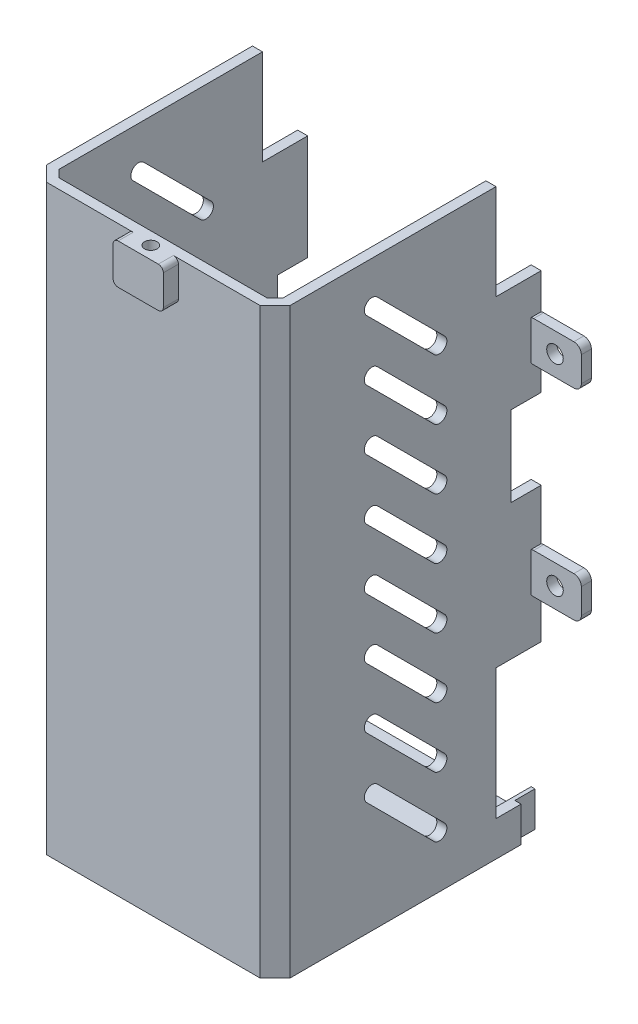
from build123d import *

# Parameters (mm, degrees)
U_2MM_START               = -26
U_2MM_DEPTH               = 116
EXTRUDE_START             = -26
EXTRUDE_377_DEPTH         = 2
EXTRUDE_START_2           = 3
SKETCH_3_R                = 1.65
EXTRUDE_M3_1_20_DEPTH     = 2
SKETCH_4_R                = 1.65
EXTRUDE_M3_1_60_DEPTH     = 2
SKETCH_5_R                = 1.65
EXTRUDE_M3_1_20_2_DEPTH   = 2
SKETCH_6_R                = 1.65
EXTRUDE_M3_1_60_2_DEPTH   = 2
CUT_EXTRUDE_START         = 3
CUT_EXTRUDE_836_DEPTH     = 9
CUT_EXTRUDE_946_DEPTH     = 6
CUT_EXTRUDE_45_DEPTH      = 60
CUT_EXTRUDE_45_DEPTH_BACK = 60
EXTRUDE_START_3           = 54
EXTRUDE_1269_DEPTH        = 5
CUT_EXTRUDE_START_2       = 83
SKETCH_11_R               = 1.25
CUT_EXTRUDE_M3_7_DEPTH    = 7
CUT_EXTRUDE_1485_DEPTH    = 4


with BuildPart() as part:
    # 草图1 → 后抽U形电池仓_2mm主壁_斜切肩 (new body)
    with BuildSketch(Plane(origin=(0, 0, 0), x_dir=(1, 0, 0), z_dir=(0, 1, 0)).offset(U_2MM_START)):
        Polygon((-24.25, -3), (-24.25, -53), (-21.25, -56), (21.25, -56), (24.25, -53), (24.25, -3), (22.25, -3), (22.25, -52.5), (20.75, -54), (-20.75, -54), (-22.25, -52.5), (-22.25, -3), align=None)
    extrude(amount=U_2MM_DEPTH)

    # 草图2 → Extrude 377 (add)
    with BuildSketch(Plane(origin=(0, 0, 0), x_dir=(1, 0, 0), z_dir=(0, 1, 0)).offset(EXTRUDE_START)):
        Polygon((-24.25, -3), (-24.25, -53), (-21.25, -56), (21.25, -56), (24.25, -53), (24.25, -3), align=None)
    extrude(amount=EXTRUDE_377_DEPTH)

    # 草图3 → Extrude M3__-1_20 (add)
    with BuildSketch(Plane.XY.offset(EXTRUDE_START_2)):
        with BuildLine():
            Line((-32.75, 16), (-24.75, 16))
            ThreePointArc((-24.75, 16), (-23.689339828, 16.439339828), (-23.25, 17.5))
            Line((-23.25, 17.5), (-23.25, 22.5))
            ThreePointArc((-23.25, 22.5), (-23.689339828, 23.560660172), (-24.75, 24))
            Line((-24.75, 24), (-32.75, 24))
            ThreePointArc((-32.75, 24), (-33.810660172, 23.560660172), (-34.25, 22.5))
            Line((-34.25, 22.5), (-34.25, 17.5))
            ThreePointArc((-34.25, 17.5), (-33.810660172, 16.439339828), (-32.75, 16))
        make_face()
        with Locations((-29, 20)):
            Circle(SKETCH_3_R, mode=Mode.SUBTRACT)
    extrude(amount=EXTRUDE_M3_1_20_DEPTH)

    # 草图4 → Extrude M3__-1_60 (add)
    with BuildSketch(Plane.XY.offset(EXTRUDE_START_2)):
        with BuildLine():
            Line((-32.75, 56), (-24.75, 56))
            ThreePointArc((-24.75, 56), (-23.689339828, 56.439339828), (-23.25, 57.5))
            Line((-23.25, 57.5), (-23.25, 62.5))
            ThreePointArc((-23.25, 62.5), (-23.689339828, 63.560660172), (-24.75, 64))
            Line((-24.75, 64), (-32.75, 64))
            ThreePointArc((-32.75, 64), (-33.810660172, 63.560660172), (-34.25, 62.5))
            Line((-34.25, 62.5), (-34.25, 57.5))
            ThreePointArc((-34.25, 57.5), (-33.810660172, 56.439339828), (-32.75, 56))
        make_face()
        with Locations((-29, 60)):
            Circle(SKETCH_4_R, mode=Mode.SUBTRACT)
    extrude(amount=EXTRUDE_M3_1_60_DEPTH)

    # 草图5 → Extrude M3__1_20 2 (add)
    with BuildSketch(Plane.XY.offset(EXTRUDE_START_2)):
        with BuildLine():
            Line((24.75, 16), (32.75, 16))
            ThreePointArc((32.75, 16), (33.810660172, 16.439339828), (34.25, 17.5))
            Line((34.25, 17.5), (34.25, 22.5))
            ThreePointArc((34.25, 22.5), (33.810660172, 23.560660172), (32.75, 24))
            Line((32.75, 24), (24.75, 24))
            ThreePointArc((24.75, 24), (23.689339828, 23.560660172), (23.25, 22.5))
            Line((23.25, 22.5), (23.25, 17.5))
            ThreePointArc((23.25, 17.5), (23.689339828, 16.439339828), (24.75, 16))
        make_face()
        with Locations((29, 20)):
            Circle(SKETCH_5_R, mode=Mode.SUBTRACT)
    extrude(amount=EXTRUDE_M3_1_20_2_DEPTH)

    # 草图6 → Extrude M3__1_60 2 (add)
    with BuildSketch(Plane.XY.offset(EXTRUDE_START_2)):
        with BuildLine():
            Line((24.75, 56), (32.75, 56))
            ThreePointArc((32.75, 56), (33.810660172, 56.439339828), (34.25, 57.5))
            Line((34.25, 57.5), (34.25, 62.5))
            ThreePointArc((34.25, 62.5), (33.810660172, 63.560660172), (32.75, 64))
            Line((32.75, 64), (24.75, 64))
            ThreePointArc((24.75, 64), (23.689339828, 63.560660172), (23.25, 62.5))
            Line((23.25, 62.5), (23.25, 57.5))
            ThreePointArc((23.25, 57.5), (23.689339828, 56.439339828), (24.75, 56))
        make_face()
        with Locations((29, 60)):
            Circle(SKETCH_6_R, mode=Mode.SUBTRACT)
    extrude(amount=EXTRUDE_M3_1_60_2_DEPTH)

    # 草图7 → Cut-Extrude 836 (cut)
    with BuildSketch(Plane.XY.offset(CUT_EXTRUDE_START)):
        with BuildLine():
            Line((-33, -19), (33, -19))
            ThreePointArc((33, -19), (34.414213562, -18.414213562), (35, -17))
            Line((35, -17), (35, 5))
            ThreePointArc((35, 5), (34.414213562, 6.414213562), (33, 7))
            Line((33, 7), (-33, 7))
            ThreePointArc((-33, 7), (-34.414213562, 6.414213562), (-35, 5))
            Line((-35, 5), (-35, -17))
            ThreePointArc((-35, -17), (-34.414213562, -18.414213562), (-33, -19))
        make_face()
        with BuildLine():
            Line((-33, 71), (33, 71))
            ThreePointArc((33, 71), (34.414213562, 71.585786438), (35, 73))
            Line((35, 73), (35, 95))
            ThreePointArc((35, 95), (34.414213562, 96.414213562), (33, 97))
            Line((33, 97), (-33, 97))
            ThreePointArc((-33, 97), (-34.414213562, 96.414213562), (-35, 95))
            Line((-35, 95), (-35, 73))
            ThreePointArc((-35, 73), (-34.414213562, 71.585786438), (-33, 71))
        make_face()
    extrude(amount=CUT_EXTRUDE_836_DEPTH, mode=Mode.SUBTRACT)

    # 草图8 → Cut-Extrude 946 (cut)
    with BuildSketch(Plane.XY.offset(CUT_EXTRUDE_START)):
        with BuildLine():
            Line((-25, 34), (25, 34))
            ThreePointArc((25, 34), (26.414213562, 34.585786438), (27, 36))
            Line((27, 36), (27, 48))
            ThreePointArc((27, 48), (26.414213562, 49.414213562), (25, 50))
            Line((25, 50), (-25, 50))
            ThreePointArc((-25, 50), (-26.414213562, 49.414213562), (-27, 48))
            Line((-27, 48), (-27, 36))
            ThreePointArc((-27, 36), (-26.414213562, 34.585786438), (-25, 34))
        make_face()
    extrude(amount=CUT_EXTRUDE_946_DEPTH, mode=Mode.SUBTRACT)

    # 草图9 → 两侧45度平行短通风槽 (cut, two sides: drawn at the far end of the back side and taken through both)
    with BuildSketch(Plane(origin=(0, 0, 0), x_dir=(0, 0, -1), z_dir=(1, 0, 0)).offset(-CUT_EXTRUDE_45_DEPTH_BACK)):
        with BuildLine():
            Line((-22.221825407, -14.656854249), (-35.656854249, -1.221825407))
            ThreePointArc((-35.656854249, -1.221825407), (-37.778174593, -1.221825407), (-37.778174593, -3.343145751))
            Line((-37.778174593, -3.343145751), (-24.343145751, -16.778174593))
            ThreePointArc((-24.343145751, -16.778174593), (-22.221825407, -16.778174593), (-22.221825407, -14.656854249))
        make_face()
        with BuildLine():
            Line((-22.221825407, -2.656854249), (-35.656854249, 10.778174593))
            ThreePointArc((-35.656854249, 10.778174593), (-37.778174593, 10.778174593), (-37.778174593, 8.656854249))
            Line((-37.778174593, 8.656854249), (-24.343145751, -4.778174593))
            ThreePointArc((-24.343145751, -4.778174593), (-22.221825407, -4.778174593), (-22.221825407, -2.656854249))
        make_face()
        with BuildLine():
            Line((-22.221825407, 9.343145751), (-35.656854249, 22.778174593))
            ThreePointArc((-35.656854249, 22.778174593), (-37.778174593, 22.778174593), (-37.778174593, 20.656854249))
            Line((-37.778174593, 20.656854249), (-24.343145751, 7.221825407))
            ThreePointArc((-24.343145751, 7.221825407), (-22.221825407, 7.221825407), (-22.221825407, 9.343145751))
        make_face()
        with BuildLine():
            Line((-22.221825407, 21.343145751), (-35.656854249, 34.778174593))
            ThreePointArc((-35.656854249, 34.778174593), (-37.778174593, 34.778174593), (-37.778174593, 32.656854249))
            Line((-37.778174593, 32.656854249), (-24.343145751, 19.221825407))
            ThreePointArc((-24.343145751, 19.221825407), (-22.221825407, 19.221825407), (-22.221825407, 21.343145751))
        make_face()
        with BuildLine():
            Line((-22.221825407, 33.343145751), (-35.656854249, 46.778174593))
            ThreePointArc((-35.656854249, 46.778174593), (-37.778174593, 46.778174593), (-37.778174593, 44.656854249))
            Line((-37.778174593, 44.656854249), (-24.343145751, 31.221825407))
            ThreePointArc((-24.343145751, 31.221825407), (-22.221825407, 31.221825407), (-22.221825407, 33.343145751))
        make_face()
        with BuildLine():
            Line((-22.221825407, 45.343145751), (-35.656854249, 58.778174593))
            ThreePointArc((-35.656854249, 58.778174593), (-37.778174593, 58.778174593), (-37.778174593, 56.656854249))
            Line((-37.778174593, 56.656854249), (-24.343145751, 43.221825407))
            ThreePointArc((-24.343145751, 43.221825407), (-22.221825407, 43.221825407), (-22.221825407, 45.343145751))
        make_face()
        with BuildLine():
            Line((-22.221825407, 57.343145751), (-35.656854249, 70.778174593))
            ThreePointArc((-35.656854249, 70.778174593), (-37.778174593, 70.778174593), (-37.778174593, 68.656854249))
            Line((-37.778174593, 68.656854249), (-24.343145751, 55.221825407))
            ThreePointArc((-24.343145751, 55.221825407), (-22.221825407, 55.221825407), (-22.221825407, 57.343145751))
        make_face()
        with BuildLine():
            Line((-22.221825407, 69.343145751), (-35.656854249, 82.778174593))
            ThreePointArc((-35.656854249, 82.778174593), (-37.778174593, 82.778174593), (-37.778174593, 80.656854249))
            Line((-37.778174593, 80.656854249), (-24.343145751, 67.221825407))
            ThreePointArc((-24.343145751, 67.221825407), (-22.221825407, 67.221825407), (-22.221825407, 69.343145751))
        make_face()
    extrude(amount=CUT_EXTRUDE_45_DEPTH + CUT_EXTRUDE_45_DEPTH_BACK, mode=Mode.SUBTRACT)

    # 草图10 → Extrude 1269 (add)
    with BuildSketch(Plane.XY.offset(EXTRUDE_START_3)):
        with BuildLine():
            Line((-4, 82), (4, 82))
            ThreePointArc((4, 82), (4.707106781, 82.292893219), (5, 83))
            Line((5, 83), (5, 89))
            ThreePointArc((5, 89), (4.707106781, 89.707106781), (4, 90))
            Line((4, 90), (-4, 90))
            ThreePointArc((-4, 90), (-4.707106781, 89.707106781), (-5, 89))
            Line((-5, 89), (-5, 83))
            ThreePointArc((-5, 83), (-4.707106781, 82.292893219), (-4, 82))
        make_face()
    extrude(amount=EXTRUDE_1269_DEPTH)

    # 草图11 → M3后门锁扣盲孔_深7 (cut)
    with BuildSketch(Plane(origin=(0, 0, 0), x_dir=(1, 0, 0), z_dir=(0, 1, 0)).offset(CUT_EXTRUDE_START_2)):
        with Locations(Location((0, -56.5, 0), (0, 0, 270))):
            Circle(SKETCH_11_R)
    extrude(amount=CUT_EXTRUDE_M3_7_DEPTH, mode=Mode.SUBTRACT)

    # 草图12 → Cut-Extrude 1485 (cut)
    with BuildSketch(Plane.XY.offset(CUT_EXTRUDE_START)):
        with BuildLine():
            Line((-33, -29), (-25, -29))
            ThreePointArc((-25, -29), (-23.585786438, -28.414213562), (-23, -27))
            Line((-23, -27), (-23, -19))
            ThreePointArc((-23, -19), (-23.585786438, -17.585786438), (-25, -17))
            Line((-25, -17), (-33, -17))
            ThreePointArc((-33, -17), (-34.414213562, -17.585786438), (-35, -19))
            Line((-35, -19), (-35, -27))
            ThreePointArc((-35, -27), (-34.414213562, -28.414213562), (-33, -29))
        make_face()
        with BuildLine():
            Line((25, -29), (33, -29))
            ThreePointArc((33, -29), (34.414213562, -28.414213562), (35, -27))
            Line((35, -27), (35, -19))
            ThreePointArc((35, -19), (34.414213562, -17.585786438), (33, -17))
            Line((33, -17), (25, -17))
            ThreePointArc((25, -17), (23.585786438, -17.585786438), (23, -19))
            Line((23, -19), (23, -27))
            ThreePointArc((23, -27), (23.585786438, -28.414213562), (25, -29))
        make_face()
    extrude(amount=CUT_EXTRUDE_1485_DEPTH, mode=Mode.SUBTRACT)


solid = part.part
